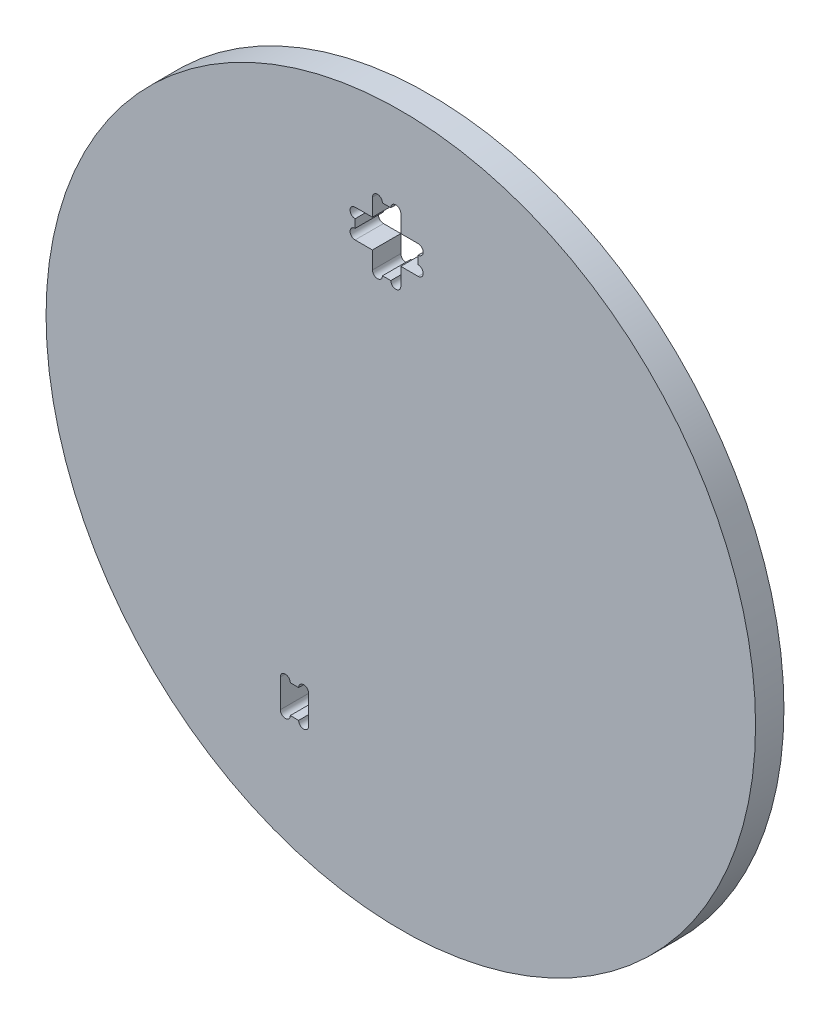
from build123d import *

# Parameters (mm, degrees)
SCHIZZO1_R                   = 225
ESTRUSIONE_ESTRUSIONE1_DEPTH = 18
TAGLIO_ESTRUSIONE3_DEPTH     = 56
TAGLIO_ESTRUSIONE4_DEPTH     = 110


with BuildPart() as part:
    # Schizzo1 → Estrusione-Estrusione1 (new body)
    with BuildSketch(Plane.XY):
        Circle(SCHIZZO1_R)
    extrude(amount=ESTRUSIONE_ESTRUSIONE1_DEPTH)

    # Schizzo1<7> → Taglio-Estrusione3 (cut)
    with BuildSketch(Plane.XY):
        with BuildLine():
            Line((-11.65, 168.428927822), (-6.35, 168.428927822))
            ThreePointArc((-6.35, 168.428927822), (-3.175, 171.603927822), (0, 168.428927822))
            Line((0, 168.428927822), (0, 157.428927822))
            Line((0, 157.428927822), (11, 157.428927822))
            ThreePointArc((11, 157.428927822), (14.175, 154.253927822), (11, 151.078927822))
            Line((11, 151.078927822), (11, 145.778927822))
            ThreePointArc((11, 145.778927822), (14.175, 142.603927822), (11, 139.428927822))
            Line((11, 139.428927822), (0, 139.428927822))
            Line((0, 139.428927822), (0, 128.428927822))
            ThreePointArc((0, 128.428927822), (-3.175, 125.253927822), (-6.35, 128.428927822))
            Line((-6.35, 128.428927822), (-11.65, 128.428927822))
            ThreePointArc((-11.65, 128.428927822), (-14.825, 125.253927822), (-18, 128.428927822))
            Line((-18, 128.428927822), (-18, 139.428927822))
            Line((-18, 139.428927822), (-29, 139.428927822))
            ThreePointArc((-29, 139.428927822), (-32.175, 142.603927822), (-29, 145.778927822))
            Line((-29, 145.778927822), (-29, 151.078927822))
            ThreePointArc((-29, 151.078927822), (-32.175, 154.253927822), (-29, 157.428927822))
            Line((-29, 157.428927822), (-18, 157.428927822))
            Line((-18, 157.428927822), (-18, 168.428927822))
            ThreePointArc((-18, 168.428927822), (-14.825, 171.603927822), (-11.65, 168.428927822))
        make_face()
    extrude(amount=TAGLIO_ESTRUSIONE3_DEPTH, mode=Mode.SUBTRACT)

    # Schizzo1<8> → Taglio-Estrusione4 (cut)
    with BuildSketch(Plane.XY):
        with BuildLine():
            Line((-70.097292154, -124.331072178), (-64.797292154, -124.331072178))
            ThreePointArc((-64.797292154, -124.331072178), (-61.622292154, -121.156072178), (-58.447292154, -124.331072178))
            Line((-58.447292154, -124.331072178), (-58.447292154, -142.331072178))
            ThreePointArc((-58.447292154, -142.331072178), (-61.622292154, -145.506072178), (-64.797292154, -142.331072178))
            Line((-64.797292154, -142.331072178), (-70.097292154, -142.331072178))
            ThreePointArc((-70.097292154, -142.331072178), (-73.272292154, -145.506072178), (-76.447292154, -142.331072178))
            Line((-76.447292154, -142.331072178), (-76.447292154, -124.331072178))
            ThreePointArc((-76.447292154, -124.331072178), (-73.272292154, -121.156072178), (-70.097292154, -124.331072178))
        make_face()
    extrude(amount=TAGLIO_ESTRUSIONE4_DEPTH, mode=Mode.SUBTRACT)


solid = part.part
